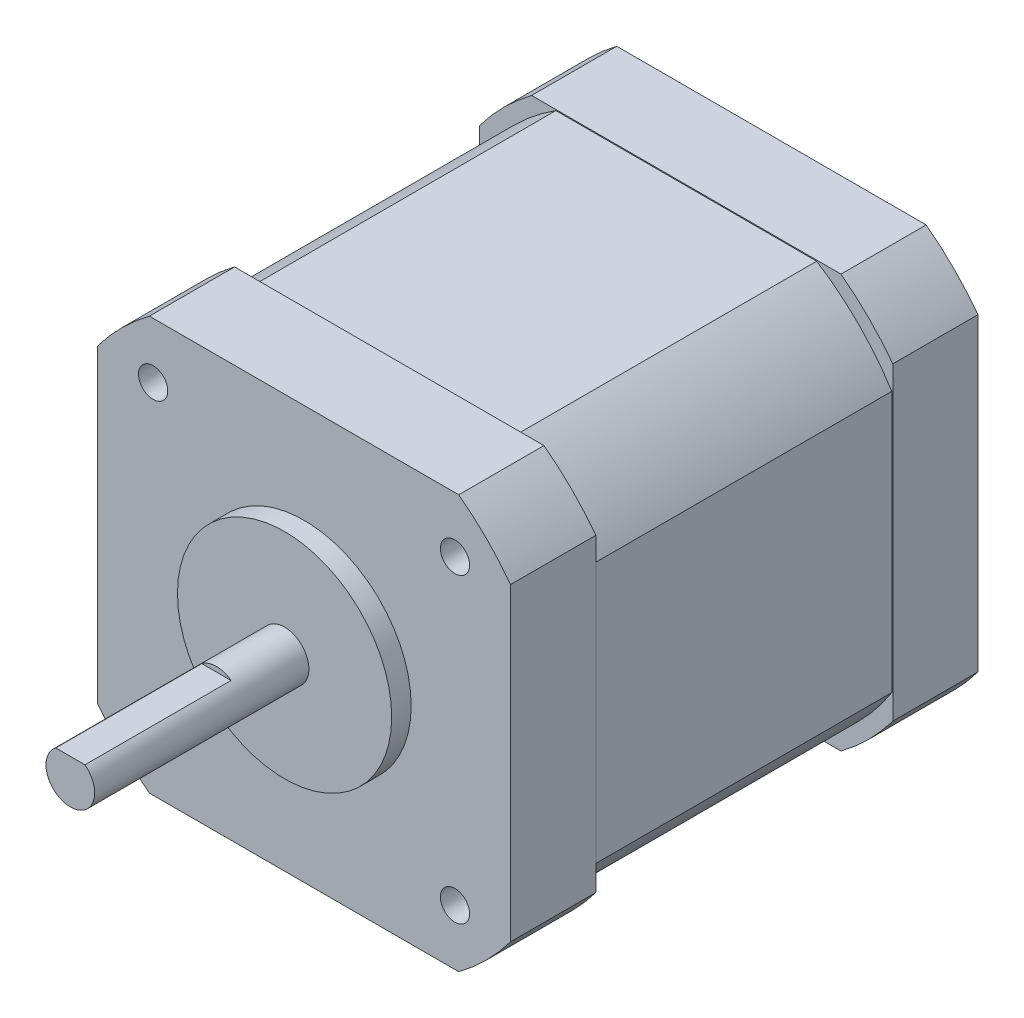
from build123d import *

# Parameters (mm, degrees)
SKETCH1_R                       = 2.5
BOSS_EXTRUDE1_DEPTH             = 24
SKETCH2_R                       = 11
BOSS_EXTRUDE2_DEPTH             = 2
SKETCH3_W                       = 42.418
SKETCH3_H                       = 42.418
BOSS_EXTRUDE3_DEPTH             = 48
CUT_EXTRUDE1_DEPTH              = 78.997713825
M3X0_5_TAPPED_HOLE1_D           = 2.5
M3X0_5_TAPPED_HOLE1_DEPTH       = 7.5
M3X0_5_TAPPED_HOLE1_CBORE_D     = 3
M3X0_5_TAPPED_HOLE1_CBORE_DEPTH = 6
M3X0_5_TAPPED_HOLE1_TIP         = 0.751075774
CUT_EXTRUDE2_START              = -15
CUT_EXTRUDE2_DEPTH              = 15
CUT_EXTRUDE3_DEPTH              = 15.25


with BuildPart() as part:
    # Sketch1 → Boss-Extrude1 (new body)
    with BuildSketch(Plane.XY):
        Circle(SKETCH1_R)
    extrude(amount=BOSS_EXTRUDE1_DEPTH)

    # Sketch2 → Boss-Extrude2 (add)
    with BuildSketch(Plane(origin=(0, 0, 0), x_dir=(-1, 0, 0), z_dir=(0, 0, -1))):
        Circle(SKETCH2_R)
    extrude(amount=-BOSS_EXTRUDE2_DEPTH)

    # Sketch3 → Boss-Extrude3 (add)
    with BuildSketch(Plane(origin=(0, 0, 0), x_dir=(-1, 0, 0), z_dir=(0, 0, -1))):
        Rectangle(SKETCH3_W, SKETCH3_H)
    extrude(amount=BOSS_EXTRUDE3_DEPTH)

    # Sketch4 → Cut-Extrude1 (cut, through all)
    with BuildSketch(Plane(origin=(0, 0, -48), x_dir=(-1, 0, 0), z_dir=(0, 0, -1))):
        with BuildLine():
            Line((-21.209, -15.887992919), (-21.209, -21.209))
            Line((-21.209, -21.209), (-15.887992919, -21.209))
            ThreePointArc((-15.887992919, -21.209), (-18.738329701, -18.738329701), (-21.209, -15.887992919))
        make_face()
        with BuildLine():
            Line((15.887992919, -21.209), (21.209, -21.209))
            Line((21.209, -21.209), (21.209, -15.887992919))
            ThreePointArc((21.209, -15.887992919), (18.738329701, -18.738329701), (15.887992919, -21.209))
        make_face()
        with BuildLine():
            Line((21.209, 15.887992919), (21.209, 21.209))
            Line((21.209, 21.209), (15.887992919, 21.209))
            ThreePointArc((15.887992919, 21.209), (18.738329701, 18.738329701), (21.209, 15.887992919))
        make_face()
        with BuildLine():
            Line((-15.887992919, 21.209), (-21.209, 21.209))
            Line((-21.209, 21.209), (-21.209, 15.887992919))
            ThreePointArc((-21.209, 15.887992919), (-18.738329701, 18.738329701), (-15.887992919, 21.209))
        make_face()
    extrude(amount=-CUT_EXTRUDE1_DEPTH, mode=Mode.SUBTRACT)

    # M3x0.5 Tapped Hole1
    with Locations(Plane.XY):
        with Locations((-15.5, 15.5), (-15.5, -15.5), (15.5, -15.5), (15.5, 15.5)):
            CounterBoreHole(M3X0_5_TAPPED_HOLE1_D / 2, M3X0_5_TAPPED_HOLE1_CBORE_D / 2, M3X0_5_TAPPED_HOLE1_CBORE_DEPTH, depth=M3X0_5_TAPPED_HOLE1_DEPTH)
            with Locations((0, 0, -(M3X0_5_TAPPED_HOLE1_DEPTH + M3X0_5_TAPPED_HOLE1_TIP / 2))):  # 118° drill point
                Cone(0, M3X0_5_TAPPED_HOLE1_D / 2, M3X0_5_TAPPED_HOLE1_TIP, mode=Mode.SUBTRACT)

    # Sketch7 → Cut-Extrude2 (cut)
    with BuildSketch(Plane.XY.offset(24).offset(CUT_EXTRUDE2_START)):
        with BuildLine():
            Line((-1.5, 2), (1.5, 2))
            ThreePointArc((1.5, 2), (0, 2.5), (-1.5, 2))
        make_face()
    extrude(amount=CUT_EXTRUDE2_DEPTH, mode=Mode.SUBTRACT)

    # Sketch8 → Cut-Extrude3 (cut, symmetric)
    with BuildSketch(Plane.XY.offset(-24)):
        with BuildLine():
            Line((15.887992919, 21.209), (-15.887992919, 21.209))
            ThreePointArc((-15.887992919, 21.209), (-18.738329701, 18.738329701), (-21.209, 15.887992919))
            Line((-21.209, 15.887992919), (-21.209, -15.887992919))
            ThreePointArc((-21.209, -15.887992919), (-18.738329701, -18.738329701), (-15.887992919, -21.209))
            Line((-15.887992919, -21.209), (15.887992919, -21.209))
            ThreePointArc((15.887992919, -21.209), (18.738329701, -18.738329701), (21.209, -15.887992919))
            Line((21.209, -15.887992919), (21.209, 15.887992919))
            ThreePointArc((21.209, 15.887992919), (18.738329701, 18.738329701), (15.887992919, 21.209))
        make_face()
        with BuildLine():
            Line((-13.394406258, 21.109), (13.394406258, 21.109))
            ThreePointArc((13.394406258, 21.109), (17.67766953, 17.67766953), (21.109, 13.394406258))
            Line((21.109, 13.394406258), (21.109, -13.394406258))
            ThreePointArc((21.109, -13.394406258), (17.67766953, -17.67766953), (13.394406258, -21.109))
            Line((13.394406258, -21.109), (-13.394406258, -21.109))
            ThreePointArc((-13.394406258, -21.109), (-17.67766953, -17.67766953), (-21.109, -13.394406258))
            Line((-21.109, -13.394406258), (-21.109, 13.394406258))
            ThreePointArc((-21.109, 13.394406258), (-17.67766953, 17.67766953), (-13.394406258, 21.109))
        make_face(mode=Mode.SUBTRACT)
    extrude(amount=CUT_EXTRUDE3_DEPTH, both=True, mode=Mode.SUBTRACT)


solid = part.part
